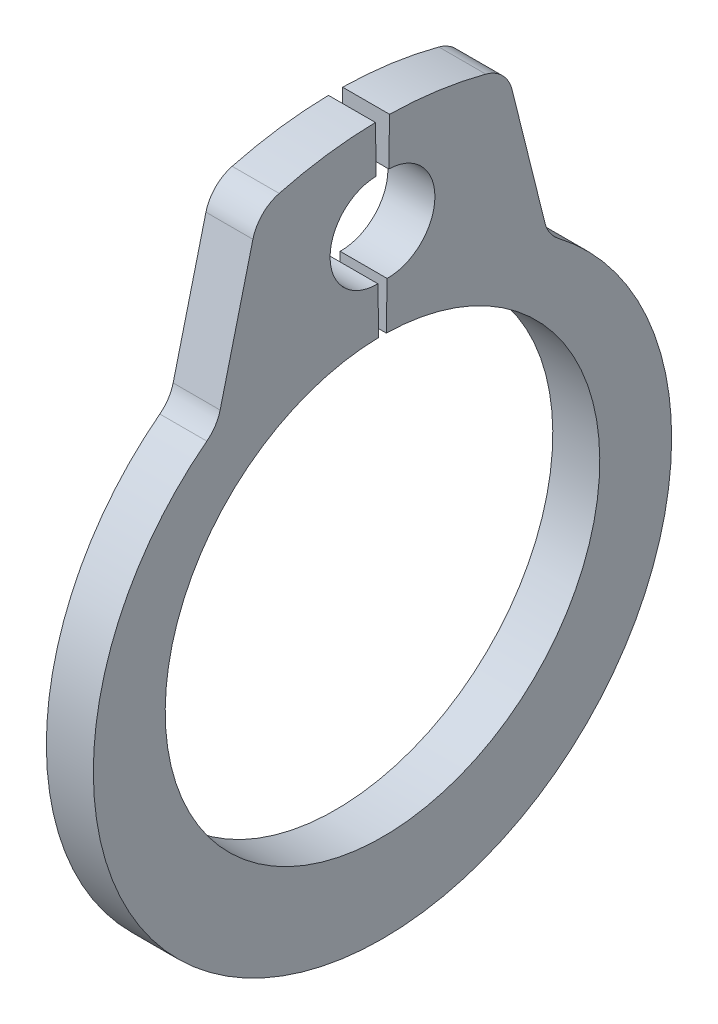
from build123d import *

# Parameters (mm, degrees)
EXTRUDE1_DEPTH = 0.4
FILLET1_R      = 0.625


with BuildPart() as part:
    # Sketch1 → Extrude1 (new, symmetric)
    with BuildSketch(Plane(origin=(0, 0, 0), x_dir=(0, 0, -1), z_dir=(1, 0, 0))):
        with BuildLine():
            Line((0.064573904, 3.699436472), (0.078535829, 4.499314628))
            ThreePointArc((0.078535829, 4.499314628), (0.89237591, 5.285230859), (0.106459679, 6.09907094))
            Line((0.106459679, 6.09907094), (0.120421604, 6.898949097))
            ThreePointArc((0.120421604, 6.898949097), (1.132430932, 6.806438142), (2.119876399, 6.56628693))
            Line((2.119876399, 6.56628693), (2.819461663, 3.760403693))
            ThreePointArc((2.819461663, 3.760403693), (0, -5.2), (-2.819461663, 3.760403693))
            Line((-2.819461663, 3.760403693), (-2.119876399, 6.56628693))
            ThreePointArc((-2.119876399, 6.56628693), (-1.132430932, 6.806438142), (-0.120421604, 6.898949097))
            Line((-0.120421604, 6.898949097), (-0.106459679, 6.09907094))
            ThreePointArc((-0.106459679, 6.09907094), (-0.89237591, 5.285230859), (-0.078535829, 4.499314628))
            Line((-0.078535829, 4.499314628), (-0.064573904, 3.699436472))
            ThreePointArc((-0.064573904, 3.699436472), (0, -3.7), (0.064573904, 3.699436472))
        make_face()
    extrude(amount=EXTRUDE1_DEPTH, both=True)

    # Fillet1
    fillet1_edges = [part.edges().sort_by_distance(p)[0] for p in [
        (0, 6.56628693, -2.119876399),
        (0, 3.760403693, -2.819461663),
        (0, 3.760403693, 2.819461663),
        (0, 6.56628693, 2.119876399),
    ]]
    fillet(fillet1_edges, radius=FILLET1_R)


solid = part.part
